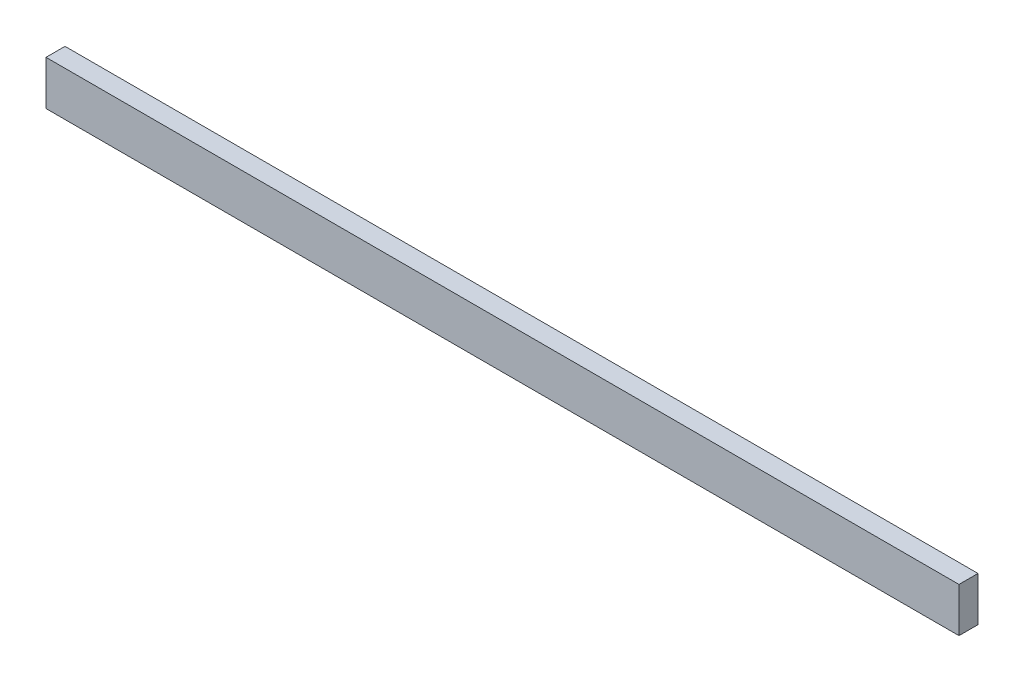
from build123d import *

# Parameters (mm, degrees)
SKETCH1_W           = 38.1
SKETCH1_H           = 88.9
BOSS_EXTRUDE1_DEPTH = 1828.8


with BuildPart() as part:
    # Sketch1 → Boss-Extrude1 (new body)
    with BuildSketch(Plane(origin=(0, 0, 0), x_dir=(0, 0, -1), z_dir=(1, 0, 0))):
        with Locations((19.05, 44.45)):
            Rectangle(SKETCH1_W, SKETCH1_H)
    extrude(amount=BOSS_EXTRUDE1_DEPTH)


solid = part.part
